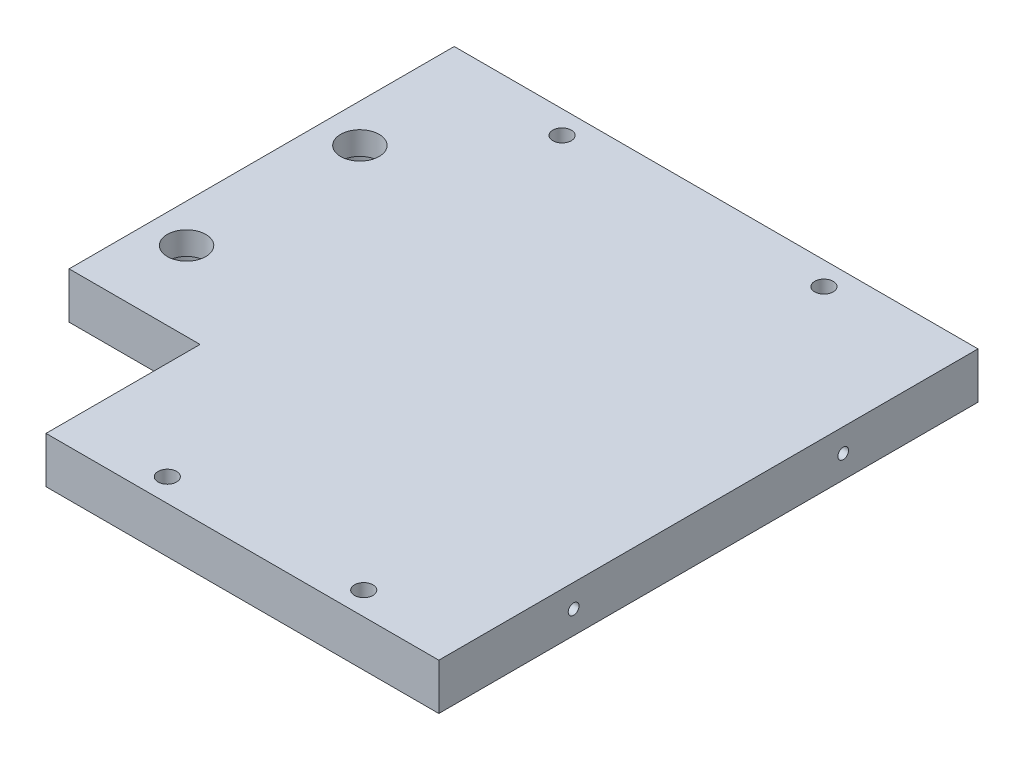
from build123d import *

# Parameters (mm, degrees)
SKETCH_1_W          = 25.5
SKETCH_1_H          = 10
EXTRUDE_1_DEPTH     = 3
SKETCH_2_R          = 1.25
SKETCH_2_R_2        = 0.6
CUT_EXTRUDE_1_DEPTH = 29.359301825
SKETCH_2_3_R        = 2
SKETCH_2_3_R_2      = 1
CUT_EXTRUDE_2_DEPTH = 1.5
SKETCH_3_R          = 0.35
CUT_EXTRUDE_3_DEPTH = 3


with BuildPart() as part:
    # 草图1 → 凸台-拉伸1 (new body)
    with BuildSketch(Plane(origin=(0, 0, 0), x_dir=(1, 0, 0), z_dir=(0, 1, 0))):
        Polygon((-17, 12.5), (-17, -12.5), (-8.5, -12.5), (17, -12.5), (17, 12.5), align=None)
        with Locations((4.25, -17.5)):
            Rectangle(SKETCH_1_W, SKETCH_1_H)
    extrude(amount=EXTRUDE_1_DEPTH)

    # 草图2 → 切除-拉伸1 (cut, through all)
    with BuildSketch(Plane(origin=(0, 0, 0), x_dir=(-1, 0, 0), z_dir=(0, -1, 0))):
        with Locations((14.499999998, -7.374985298)):
            Circle(SKETCH_2_R)
        with Locations((14.499999998, 3.875014702)):
            Circle(SKETCH_2_R)
        with Locations((-10.625, -21)):
            Circle(SKETCH_2_R_2)
        with Locations((2.125, -21)):
            Circle(SKETCH_2_R_2)
        with Locations((-8.5, 11)):
            Circle(SKETCH_2_R_2)
        with Locations((8.5, 11)):
            Circle(SKETCH_2_R_2)
    extrude(amount=-CUT_EXTRUDE_1_DEPTH, mode=Mode.SUBTRACT)

    # 草图2<3> → 切除-拉伸2 (cut)
    with BuildSketch(Plane(origin=(0, 0, 0), x_dir=(-1, 0, 0), z_dir=(0, -1, 0))):
        with Locations((14.499999998, 3.875014702)):
            Circle(SKETCH_2_3_R)
        with Locations((14.499999998, -7.374985298)):
            Circle(SKETCH_2_3_R)
        with Locations((-10.625, -21)):
            Circle(SKETCH_2_3_R_2)
        with Locations((2.125, -21)):
            Circle(SKETCH_2_3_R_2)
        with Locations((-8.5, 11)):
            Circle(SKETCH_2_3_R_2)
        with Locations((8.5, 11)):
            Circle(SKETCH_2_3_R_2)
    extrude(amount=-CUT_EXTRUDE_2_DEPTH, mode=Mode.SUBTRACT)

    # 草图3 → 切除-拉伸3 (cut)
    with BuildSketch(Plane(origin=(17, 0, 0), x_dir=(0, 0, -1), z_dir=(1, 0, 0))):
        with Locations((3.75, 1.5)):
            Circle(SKETCH_3_R)
        with Locations((-13.75, 1.5)):
            Circle(SKETCH_3_R)
    extrude(amount=-CUT_EXTRUDE_3_DEPTH, mode=Mode.SUBTRACT)


solid = part.part
